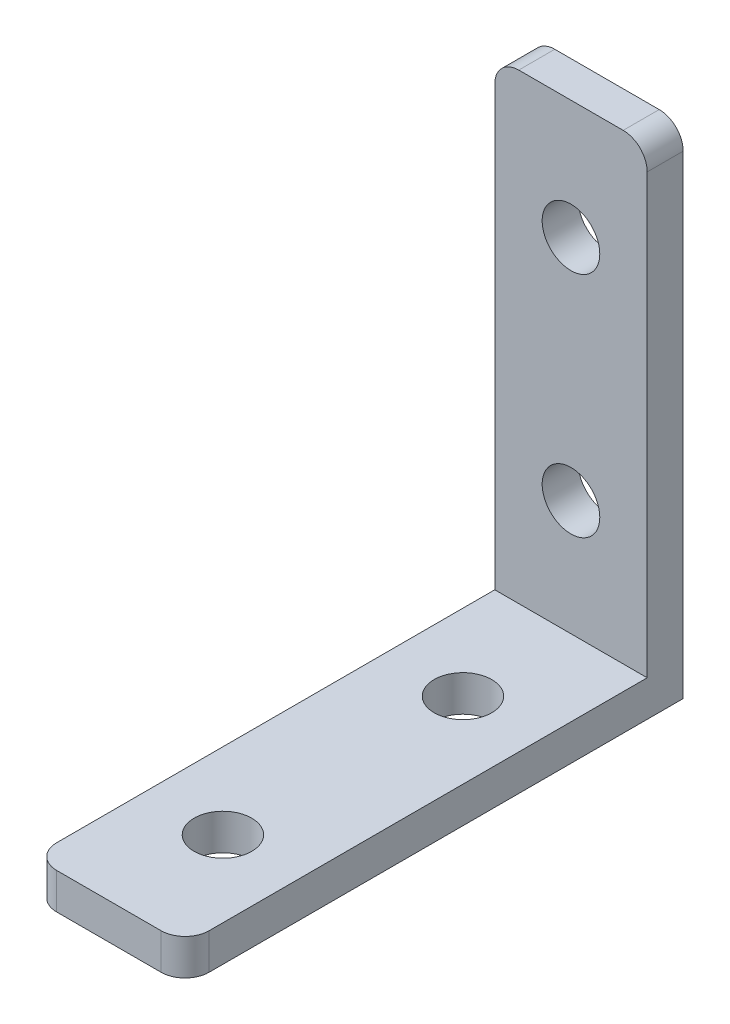
from build123d import *

# Parameters (mm, degrees)
ESBO_O1_W                = 12.7
ESBO_O1_H                = 41.5
ESBO_O1_R                = 2.4
RESSALTO_EXTRUS_O1_DEPTH = 3
ESBO_O2_W                = 12.7
ESBO_O2_H                = 3
RESSALTO_EXTRUS_O2_DEPTH = 38.5
ESBO_O3_R                = 2.4
CORTE_EXTRUS_O1_DEPTH    = 41.5
FILETE1_R                = 2


with BuildPart() as part:
    # Esboço1 → Ressalto-extrusão1 (new body)
    with BuildSketch(Plane.XY):
        Rectangle(ESBO_O1_W, ESBO_O1_H)
        with Locations((0, 10.85)):
            Circle(ESBO_O1_R, mode=Mode.SUBTRACT)
        with Locations((0, -8.15)):
            Circle(ESBO_O1_R, mode=Mode.SUBTRACT)
    extrude(amount=RESSALTO_EXTRUS_O1_DEPTH)

    # Esboço2 → Ressalto-extrusão2 (add)
    with BuildSketch(Plane.XY.offset(3)):
        with Locations((0, -19.25)):
            Rectangle(ESBO_O2_W, ESBO_O2_H)
    extrude(amount=RESSALTO_EXTRUS_O2_DEPTH)

    # Esboço3 → Corte-extrusão1 (cut)
    with BuildSketch(Plane(origin=(0, -17.75, 0), x_dir=(1, 0, 0), z_dir=(0, 1, 0))):
        with Locations(Location((0, -12, 0), (0, 0, 270))):
            Circle(ESBO_O3_R)
        with Locations(Location((0, -32, 0), (0, 0, 270))):
            Circle(ESBO_O3_R)
    extrude(amount=-CORTE_EXTRUS_O1_DEPTH, mode=Mode.SUBTRACT)

    # Filete1
    filete1_edges = [part.edges().sort_by_distance(p)[0] for p in [
        (6.35, -19.25, 41.5),
        (-6.35, -19.25, 41.5),
        (-6.35, 20.75, 1.5),
        (6.35, 20.75, 1.5),
    ]]
    fillet(filete1_edges, radius=FILETE1_R)


solid = part.part
